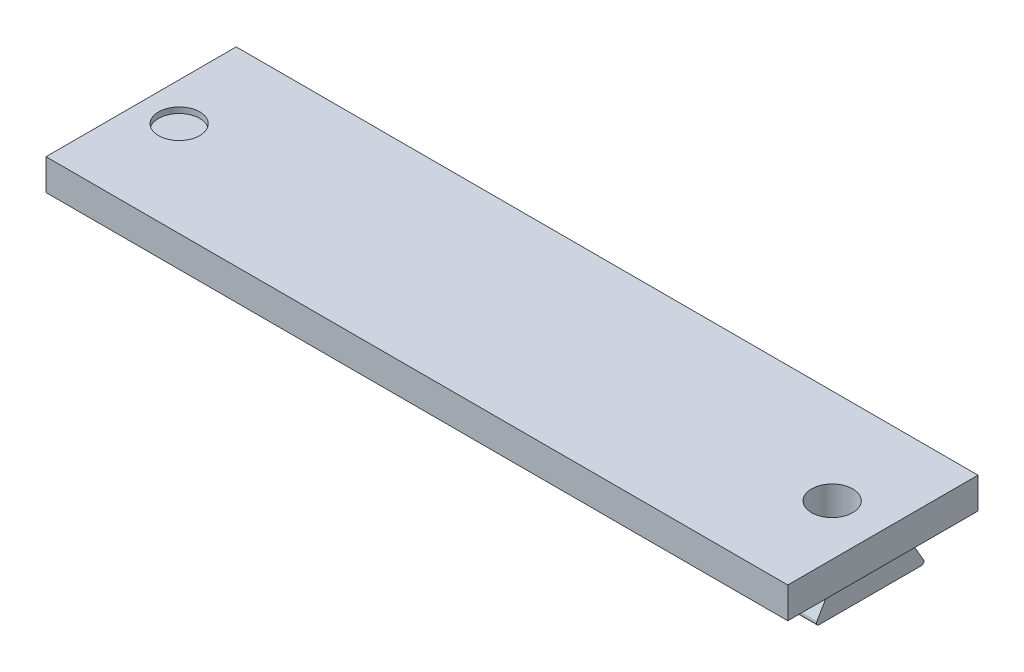
from build123d import *

# Parameters (mm, degrees)
BOSS_EXTRUDE2_DEPTH = 57.5
FILLET1_R           = 0.4
FILLET2_R           = 0.5
SKETCH5_R           = 4.25
CUT_EXTRUDE1_DEPTH  = 3
SKETCH6_R           = 3.25
CUT_EXTRUDE2_DEPTH  = 5.9
SKETCH7_R           = 4.25
CUT_EXTRUDE3_DEPTH  = 8
SKETCH8_R           = 3.25
CUT_EXTRUDE4_DEPTH  = 0.9
SKETCH9_W           = 30
SKETCH9_H           = 4.9
BOSS_EXTRUDE3_DEPTH = 2
CHAMFER1_SIZE       = 0.5


with BuildPart() as part:
    # Sketch4 → Boss-Extrude2 (new, symmetric)
    with BuildSketch(Plane(origin=(0, 0, 0), x_dir=(0, 0, -1), z_dir=(1, 0, 0))):
        Polygon((-15, 5), (15, 5), (15, 0.1), (5.883419246, 0.1), (8.770170592, -4.9), (-8.770170592, -4.9), (-5.883419246, 0.1), (-15, 0.1), align=None)
    extrude(amount=BOSS_EXTRUDE2_DEPTH, both=True)

    # Fillet1
    fillet1_edges = [part.edges().sort_by_distance(p)[0] for p in [
        (0, -4.9, -8.770170592),
        (0, -4.9, 8.770170592),
    ]]
    fillet(fillet1_edges, radius=FILLET1_R)

    # Fillet2
    fillet2_edges = [part.edges().sort_by_distance(p)[0] for p in [
        (0, 0.1, -5.883419246),
        (0, 0.1, 5.883419246),
    ]]
    fillet(fillet2_edges, radius=FILLET2_R)

    # Sketch5 → Cut-Extrude1 (cut)
    with BuildSketch(Plane.XZ.offset(4.9)):
        with Locations(Location((51.5, 0, 0), (0, 0, 270))):
            Circle(SKETCH5_R)
    extrude(amount=-CUT_EXTRUDE1_DEPTH, mode=Mode.SUBTRACT)

    # Sketch6 → Cut-Extrude2 (cut)
    with BuildSketch(Plane(origin=(0, 5, 0), x_dir=(1, 0, 0), z_dir=(0, 1, 0))):
        with Locations(Location((51.5, 0, 0), (0, 0, 270))):
            Circle(SKETCH6_R)
    extrude(amount=-CUT_EXTRUDE2_DEPTH, mode=Mode.SUBTRACT)

    # Sketch7 → Cut-Extrude3 (cut)
    with BuildSketch(Plane.XZ.offset(4.9)):
        with Locations(Location((-51.5, 0, 0), (0, 0, 270))):
            Circle(SKETCH7_R)
    extrude(amount=-CUT_EXTRUDE3_DEPTH, mode=Mode.SUBTRACT)

    # Sketch8 → Cut-Extrude4 (cut)
    with BuildSketch(Plane(origin=(0, 5, 0), x_dir=(1, 0, 0), z_dir=(0, 1, 0))):
        with Locations(Location((-51.5, 0, 0), (0, 0, 270))):
            Circle(SKETCH8_R)
    extrude(amount=-CUT_EXTRUDE4_DEPTH, mode=Mode.SUBTRACT)

    # Sketch9 → Boss-Extrude3 (add)
    with BuildSketch(Plane(origin=(57.5, 0, 0), x_dir=(0, 0, -1), z_dir=(1, 0, 0))):
        with Locations((0, 2.55)):
            Rectangle(SKETCH9_W, SKETCH9_H)
    extrude(amount=BOSS_EXTRUDE3_DEPTH)

    # Chamfer1
    chamfer1_edges = [part.edges().sort_by_distance(p)[0] for p in [
        (51.5, -4.9, 4.25),
        (-51.5, -4.9, 4.25),
    ]]
    chamfer(chamfer1_edges, length=CHAMFER1_SIZE)


solid = part.part
